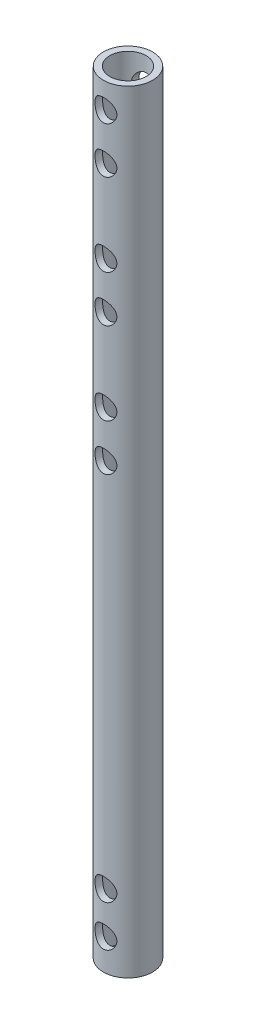
from build123d import *

# Parameters (mm, degrees)
SKETCH1_R               = 9.55
SKETCH1_R_2             = 7.05
BOSS_EXTRUDE1_DEPTH     = 300
CUT_EXTRUDE1_DEPTH      = 301.303854454
CUT_EXTRUDE1_DEPTH_BACK = 301.303854454
SKETCH2_R               = 4.25


with BuildPart() as part:
    # Sketch1 → Boss-Extrude1 (new body)
    with BuildSketch(Plane(origin=(0, 0, 0), x_dir=(1, 0, 0), z_dir=(0, 1, 0))):
        with Locations(Location((0, 0, 0), (0, 0, 270))):
            Circle(SKETCH1_R)
        with Locations(Location((0, 0, 0), (0, 0, 270))):
            Circle(SKETCH1_R_2, mode=Mode.SUBTRACT)
    extrude(amount=BOSS_EXTRUDE1_DEPTH)

    # Sketch2 → Cut-Extrude1 (cut, two sides: drawn at the far end of the back side and taken through both)
    with BuildSketch(Plane.XY.offset(-CUT_EXTRUDE1_DEPTH_BACK)):
        with Locations((0, 12)):
            Circle(SKETCH2_R)
        with Locations((0, 28)):
            Circle(SKETCH2_R)
        with Locations((0, 272)):
            Circle(SKETCH2_R)
        with Locations((0, 290)):
            Circle(SKETCH2_R)
        with Locations((0, 222)):
            Circle(SKETCH2_R)
        with Locations((0, 240)):
            Circle(SKETCH2_R)
        with Locations((0, 172)):
            Circle(SKETCH2_R)
        with Locations((0, 190)):
            Circle(SKETCH2_R)
    extrude(amount=CUT_EXTRUDE1_DEPTH + CUT_EXTRUDE1_DEPTH_BACK, mode=Mode.SUBTRACT)


solid = part.part
